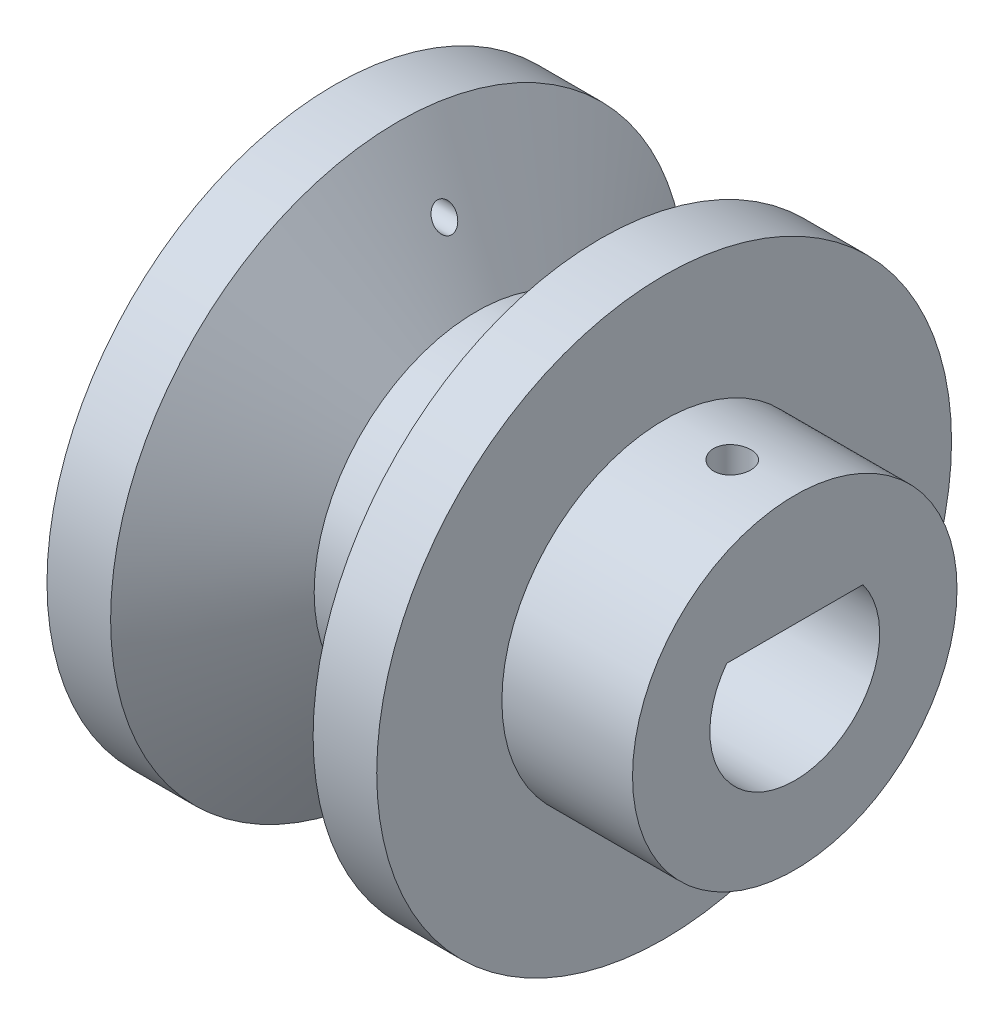
from build123d import *

# Parameters (mm, degrees)
SKETCH_2_R               = 1.385
CUT_EXTRUDE_1_DEPTH      = 10
SKETCH_3_R               = 6.5
CUT_EXTRUDE_2_DEPTH      = 35
CUT_EXTRUDE_3_DEPTH      = 2
CUT_EXTRUDE_3_DEPTH_BACK = 10
SKETCH_5_R               = 1.425
SKETCH_11_W              = 11.431167052
SKETCH_11_H              = 3.4
EXTRUDE_3_DEPTH          = 35
SKETCH_13_R              = 1.425
CUT_EXTRUDE_4_DEPTH      = 16
SKETCH_14_R              = 0.877374271
CUT_EXTRUDE_5_DEPTH      = 12


with BuildPart() as part:
    # 草圖1 → 旋轉1 (revolve)
    with BuildSketch(Plane.XY, mode=Mode.PRIVATE) as revolve_1_sk:
        Polygon((0, 0), (0, 22), (4.87, 22), (10.87, 12.418858447), (14.37, 12.418858447), (20.37, 22), (25.24, 22), (25.24, 12.418858447), (35.24, 12.418858447), (35.24, 0), align=None)
    revolve(revolve_1_sk.sketch.rotate(Axis((-743.15639781, 0, 0), (1, 0, 0)), 90), axis=Axis((-743.15639781, 0, 0), (1, 0, 0)))

    # 草圖2 → 除料-伸長1 (cut)
    with BuildSketch(Plane(origin=(0, 12, 0), x_dir=(1, 0, 0), z_dir=(0, 1, 0))):
        with Locations(Location((30.456485429, 0, 0), (0, 0, 270))):
            Circle(SKETCH_2_R)
    extrude(amount=-CUT_EXTRUDE_1_DEPTH, mode=Mode.SUBTRACT)

    # 草圖3 → 除料-伸長2 (cut)
    with BuildSketch(Plane(origin=(35.24, 0, 0), x_dir=(0, 0, -1), z_dir=(1, 0, 0))):
        Circle(SKETCH_3_R)
    extrude(amount=-CUT_EXTRUDE_2_DEPTH, mode=Mode.SUBTRACT)

    # 草圖5 → 除料-伸長3 (cut, two sides: drawn at the far end of the back side and taken through both)
    with BuildSketch(Plane(origin=(0, 12, 0), x_dir=(1, 0, 0), z_dir=(0, 1, 0)).offset(-CUT_EXTRUDE_3_DEPTH_BACK)):
        with Locations(Location((30.456485429, 0, 0), (0, 0, 90))):
            Circle(SKETCH_5_R)
    extrude(amount=CUT_EXTRUDE_3_DEPTH + CUT_EXTRUDE_3_DEPTH_BACK, mode=Mode.SUBTRACT)

    # 草圖11 → 填料-伸長3 (add)
    with BuildSketch(Plane(origin=(35.24, 0, 0), x_dir=(0, 0, -1), z_dir=(1, 0, 0))):
        with Locations((-0.190572982, 5.582537257)):
            Rectangle(SKETCH_11_W, SKETCH_11_H)
    extrude(amount=-EXTRUDE_3_DEPTH)

    # 草圖13 → 除料-伸長4 (cut)
    with BuildSketch(Plane(origin=(0, 12, 0), x_dir=(1, 0, 0), z_dir=(0, 1, 0))):
        with Locations(Location((30.456485429, 0, 0), (0, 0, 90))):
            Circle(SKETCH_13_R)
    extrude(amount=-CUT_EXTRUDE_4_DEPTH, mode=Mode.SUBTRACT)

    # 草圖14 → 除料-伸長5 (cut)
    with BuildSketch(Plane.ZY):
        with Locations((-0.435299539, 17.00388826)):
            Circle(SKETCH_14_R)
    extrude(amount=-CUT_EXTRUDE_5_DEPTH, mode=Mode.SUBTRACT)


solid = part.part
